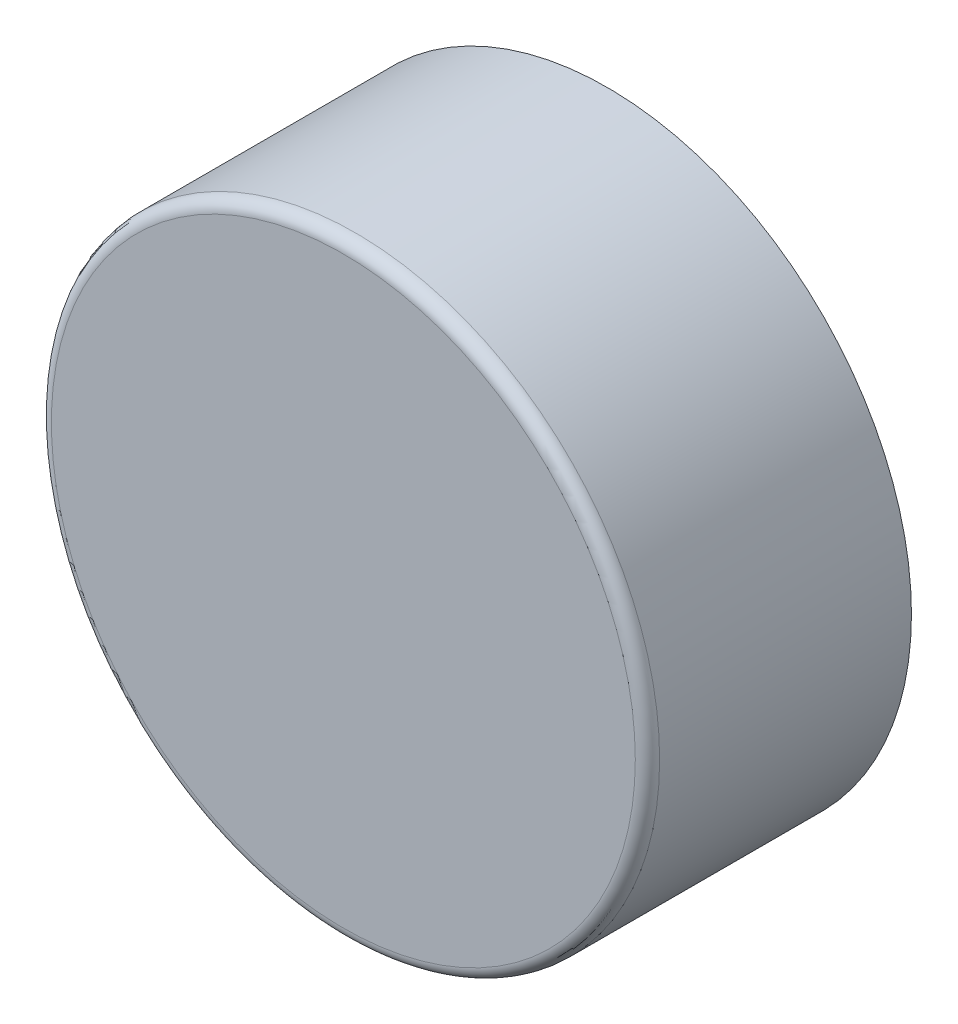
from build123d import *

# Parameters (mm, degrees)
ESQUISSE1_R        = 2.5
BOSS_EXTRU_1_DEPTH = 2.17
CONG_1_R           = 0.1


with BuildPart() as part:
    # Esquisse1 → Boss.-Extru.1 (new body)
    with BuildSketch(Plane.XY):
        Circle(ESQUISSE1_R)
    extrude(amount=BOSS_EXTRU_1_DEPTH)

    # Congé1
    cong_1_edges = [part.edges().sort_by_distance(p)[0] for p in [
        (-2.5, 0, 2.17),
    ]]
    fillet(cong_1_edges, radius=CONG_1_R)


solid = part.part
